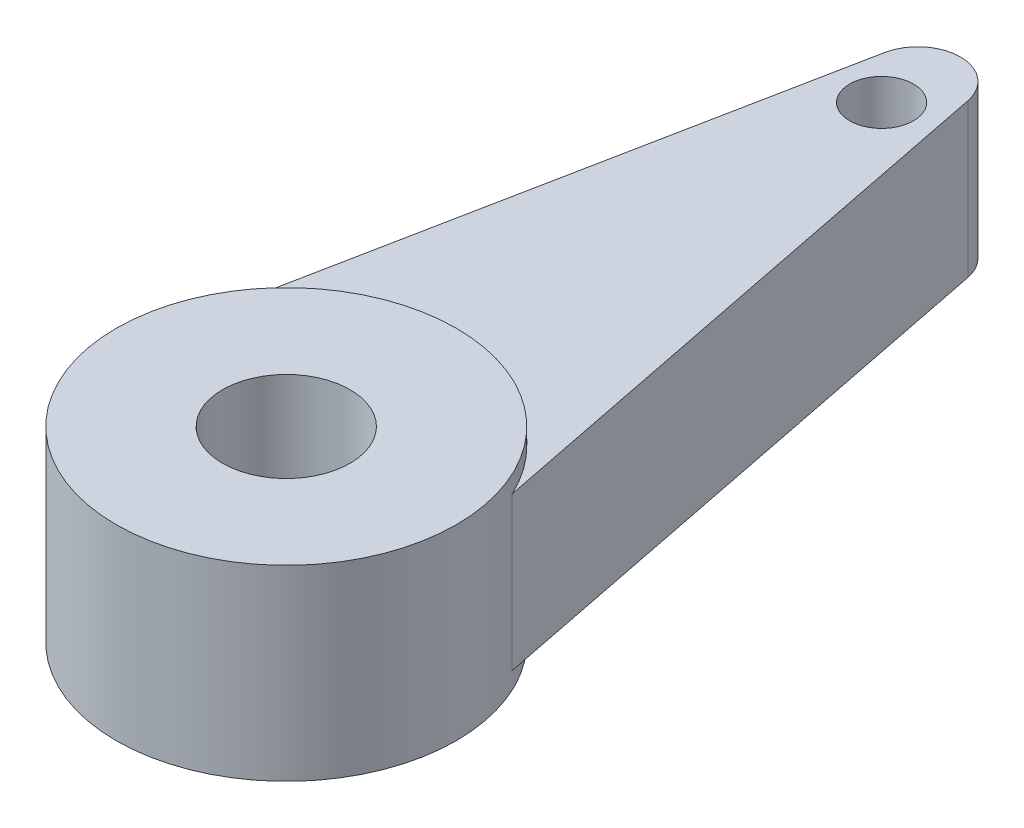
from build123d import *

# Parameters (mm, degrees)
SKETCH1_R           = 50.8
SKETCH1_R_2         = 19.05
BOSS_EXTRUDE1_DEPTH = 27.94
SKETCH3_R           = 9.525
BOSS_EXTRUDE3_DEPTH = 22.86
FILLET1_R           = 12.7


with BuildPart() as part:
    # Sketch1 → Boss-Extrude1 (new, symmetric)
    with BuildSketch(Plane(origin=(0, 0, 0), x_dir=(1, 0, 0), z_dir=(0, 1, 0))):
        with Locations(Location((0, 0, 0), (0, 0, 270))):
            Circle(SKETCH1_R)
        with Locations(Location((0, 0, 0), (0, 0, 270))):
            Circle(SKETCH1_R_2, mode=Mode.SUBTRACT)
    extrude(amount=BOSS_EXTRUDE1_DEPTH, both=True)

    # Sketch3 → Boss-Extrude3 (add, symmetric)
    with BuildSketch(Plane(origin=(0, 0, 0), x_dir=(1, 0, 0), z_dir=(0, 1, 0))):
        Polygon((-46.070521031, 21.404370862), (46.070521031, 21.404370862), (0, 254), align=None)
        with Locations(Location((0, 177.8, 0), (0, 0, 270))):
            Circle(SKETCH3_R, mode=Mode.SUBTRACT)
    extrude(amount=BOSS_EXTRUDE3_DEPTH, both=True)

    # Fillet1
    fillet1_edges = [part.edges().sort_by_distance(p)[0] for p in [
        (0, 0, -254),
    ]]
    fillet(fillet1_edges, radius=FILLET1_R)


solid = part.part
